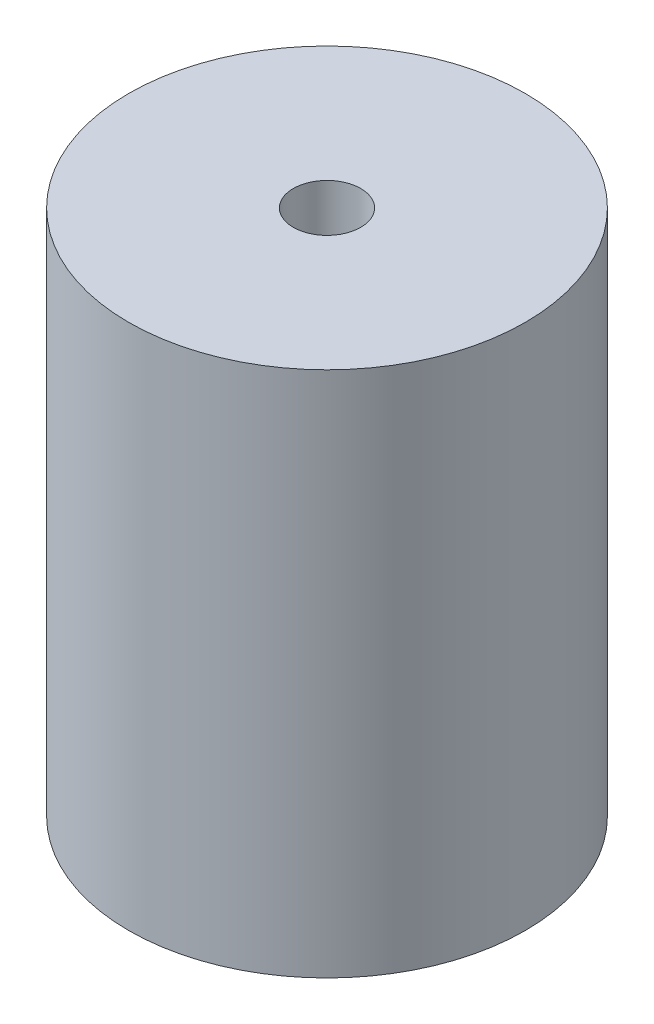
from build123d import *


with BuildPart() as part:
    # Croquis6 → Revolución2 (revolve)
    with BuildSketch(Plane.XY):
        Polygon((5.118334973, 43.663840535), (30.118334973, 43.663840535), (30.118334973, -36.336159465), (5.118334973, -36.336159465), (5.118334973, -16.336159465), (20.118334973, -16.336159465), (20.118334973, 23.663840535), (5.118334973, 23.663840535), align=None)
    revolve(axis=Axis((0, 0, 0), (0, 1, 0)))


solid = part.part
